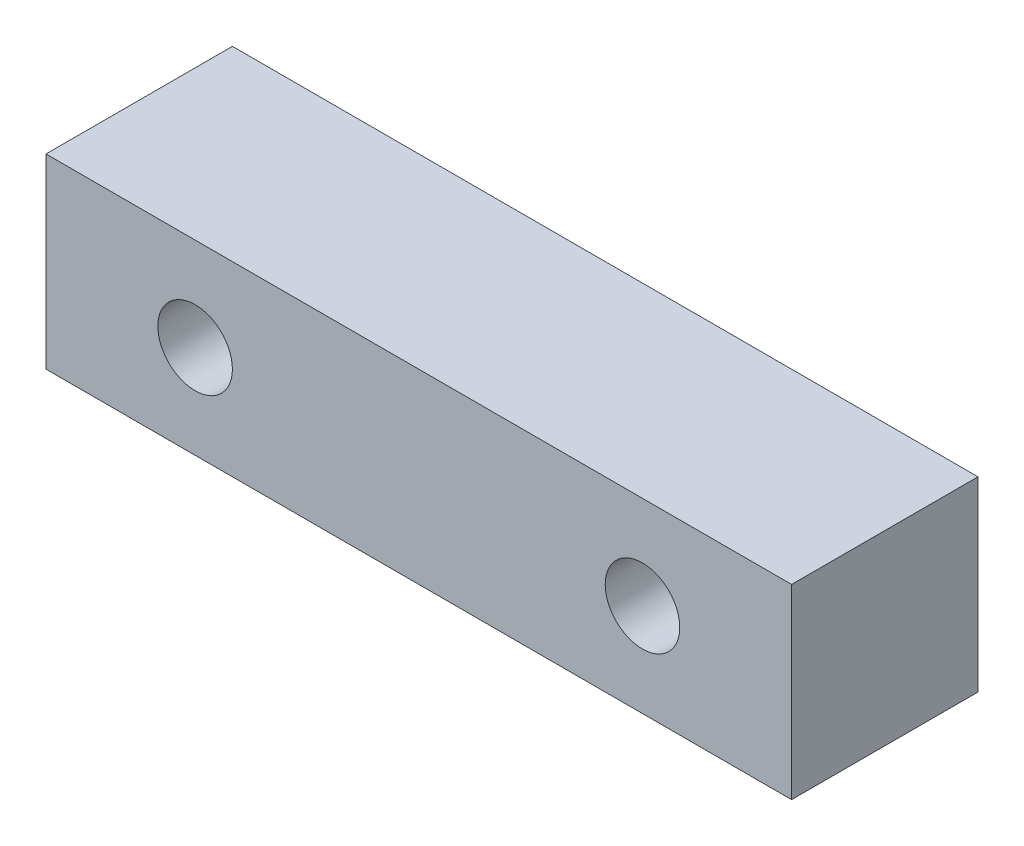
from build123d import *

# Parameters (mm, degrees)
SKETCH_1_W      = 20
SKETCH_1_H      = 5
SKETCH_1_R      = 1
EXTRUDE_1_DEPTH = 5


with BuildPart() as part:
    # 草图1 → 凸台-拉伸1 (new body)
    with BuildSketch(Plane.XY):
        Rectangle(SKETCH_1_W, SKETCH_1_H)
        with Locations((-6, 0)):
            Circle(SKETCH_1_R, mode=Mode.SUBTRACT)
        with Locations(Location((6, 0, 0), (0, 0, 180))):
            Circle(SKETCH_1_R, mode=Mode.SUBTRACT)
    extrude(amount=EXTRUDE_1_DEPTH)


solid = part.part
